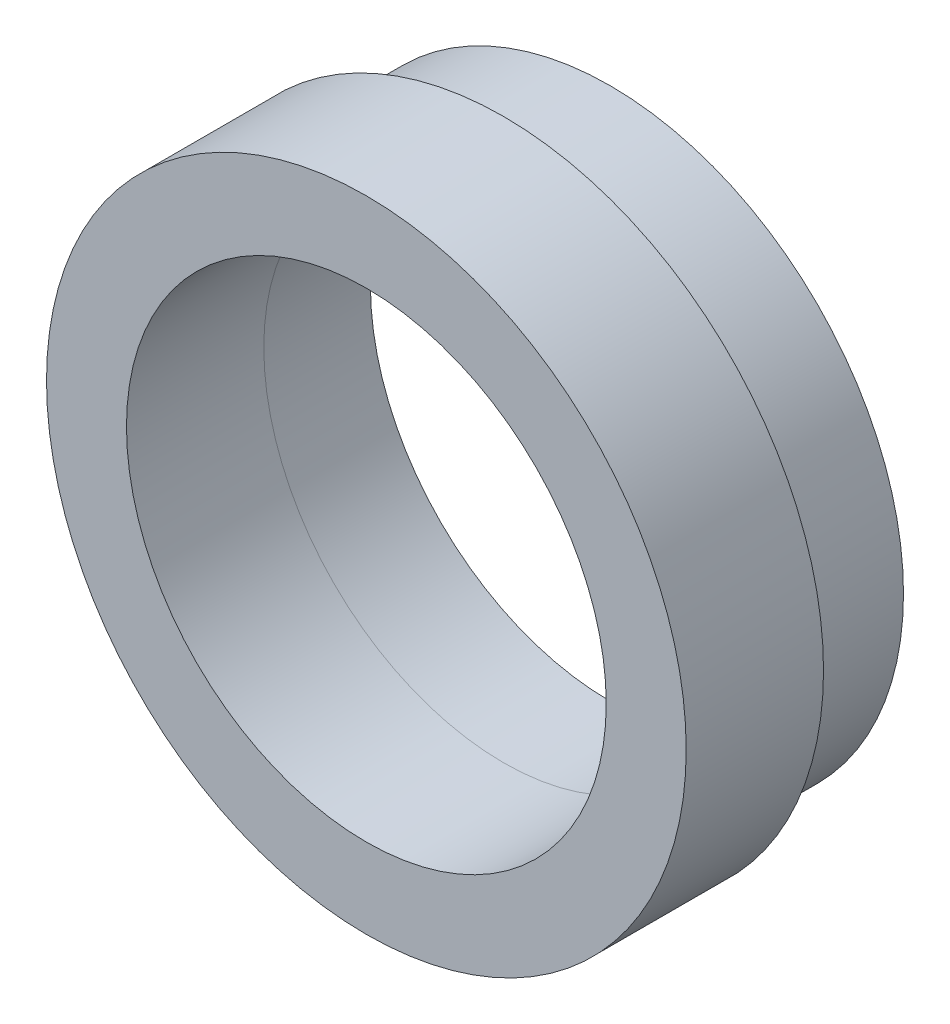
from build123d import *

# Parameters (mm, degrees)
SKETCH1_R           = 19.05
SKETCH1_R_2         = 14.2875
EXTRUDE_THIN1_DEPTH = 8.1788
SKETCH3_R           = 17.4625
SKETCH3_R_2         = 14.2875
BOSS_EXTRUDE1_DEPTH = 6.35


with BuildPart() as part:
    # Sketch1 → Extrude-Thin1 (new body)
    with BuildSketch(Plane.XY):
        Circle(SKETCH1_R)
        Circle(SKETCH1_R_2, mode=Mode.SUBTRACT)
    extrude(amount=EXTRUDE_THIN1_DEPTH)


with BuildPart() as body_2:
    # Sketch3 → Boss-Extrude1 (new body)
    with BuildSketch(Plane(origin=(0, 0, 0), x_dir=(-1, 0, 0), z_dir=(0, 0, -1))):
        Circle(SKETCH3_R)
        Circle(SKETCH3_R_2, mode=Mode.SUBTRACT)
    extrude(amount=BOSS_EXTRUDE1_DEPTH)


solid = Compound([part.part, body_2.part])
